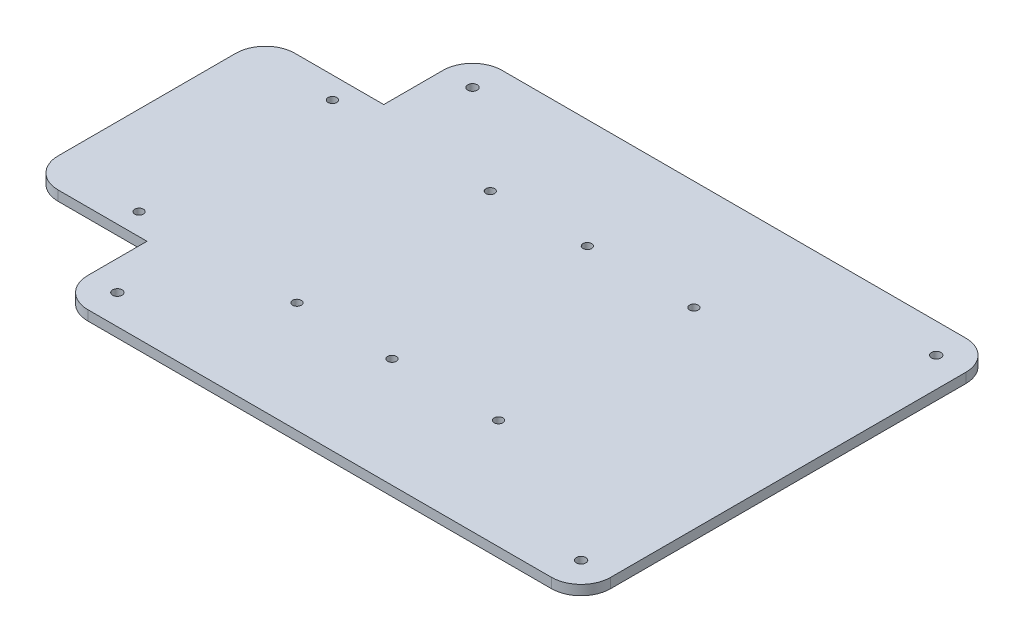
from build123d import *

# Parameters (mm, degrees)
SKETCH_1_W          = 265
SKETCH_1_H          = 210
EXTRUDE_1_DEPTH     = 5
SKETCH_3_R          = 2.4
CUT_EXTRUDE_1_DEPTH = 5
FILLET_1_R          = 15
SKETCH_4_W          = 60
SKETCH_4_H          = 120
EXTRUDE_3_DEPTH     = 5
FILLET_2_R          = 15
SKETCH_6_R          = 2.2
CUT_EXTRUDE_2_DEPTH = 24
SKETCH_7_R          = 2.2
CUT_EXTRUDE_3_DEPTH = 10


with BuildPart() as part:
    # 草图1 → 凸台-拉伸1 (new body)
    with BuildSketch(Plane(origin=(0, 0, 0), x_dir=(1, 0, 0), z_dir=(0, 1, 0))):
        Rectangle(SKETCH_1_W, SKETCH_1_H)
    extrude(amount=EXTRUDE_1_DEPTH)

    # 草图3 → 切除-拉伸1 (cut)
    with BuildSketch(Plane(origin=(0, 5, 0), x_dir=(1, 0, 0), z_dir=(0, 1, 0))):
        with Locations(Location((-117.5, 90, 0), (0, 0, 270))):
            Circle(SKETCH_3_R)
        with Locations(Location((117.5, 90, 0), (0, 0, 90))):
            Circle(SKETCH_3_R)
        with Locations(Location((117.5, -90, 0), (0, 0, 270))):
            Circle(SKETCH_3_R)
        with Locations(Location((-117.5, -90, 0), (0, 0, 90))):
            Circle(SKETCH_3_R)
    extrude(amount=-CUT_EXTRUDE_1_DEPTH, mode=Mode.SUBTRACT)

    # 圆角1
    fillet_1_edges = [part.edges().sort_by_distance(p)[0] for p in [
        (-132.5, 2.5, -105),
        (132.5, 2.5, -105),
        (132.5, 2.5, 105),
        (-132.5, 2.5, 105),
    ]]
    fillet(fillet_1_edges, radius=FILLET_1_R)

    # 草图4 → 凸台-拉伸3 (add)
    with BuildSketch(Plane(origin=(0, 0, 0), x_dir=(1, 0, 0), z_dir=(0, 1, 0))):
        with Locations((-162.5, 0)):
            Rectangle(SKETCH_4_W, SKETCH_4_H)
    extrude(amount=EXTRUDE_3_DEPTH)

    # 圆角2
    fillet_2_edges = [part.edges().sort_by_distance(p)[0] for p in [
        (-192.5, 2.5, -60),
        (-192.5, 2.5, 60),
    ]]
    fillet(fillet_2_edges, radius=FILLET_2_R)

    # 草图6 → 切除-拉伸2 (cut)
    with BuildSketch(Plane(origin=(0, 5, 0), x_dir=(1, 0, 0), z_dir=(0, 1, 0))):
        with Locations(Location((-147.5, 49, 0), (0, 0, 270))):
            Circle(SKETCH_6_R)
        with Locations(Location((-67.5, 49, 0), (0, 0, 270))):
            Circle(SKETCH_6_R)
        with Locations(Location((-67.5, -49, 0), (0, 0, 270))):
            Circle(SKETCH_6_R)
        with Locations(Location((-147.5, -49, 0), (0, 0, 270))):
            Circle(SKETCH_6_R)
    extrude(amount=-CUT_EXTRUDE_2_DEPTH, mode=Mode.SUBTRACT)

    # 草图7 → 切除-拉伸3 (cut)
    with BuildSketch(Plane(origin=(0, 5, 0), x_dir=(1, 0, 0), z_dir=(0, 1, 0))):
        with Locations(Location((-18.8, 49.5, 0), (0, 0, 270))):
            Circle(SKETCH_7_R)
        with Locations(Location((35.2, 49.5, 0), (0, 0, 270))):
            Circle(SKETCH_7_R)
        with Locations(Location((35.2, -49.5, 0), (0, 0, 270))):
            Circle(SKETCH_7_R)
        with Locations(Location((-18.8, -49.5, 0), (0, 0, 270))):
            Circle(SKETCH_7_R)
    extrude(amount=-CUT_EXTRUDE_3_DEPTH, mode=Mode.SUBTRACT)


solid = part.part
